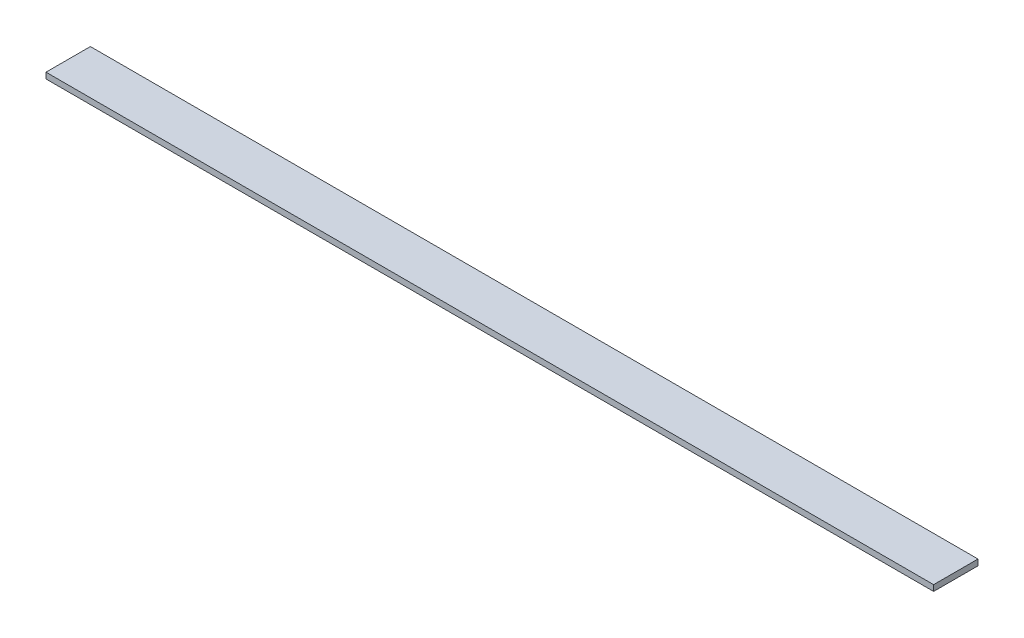
from build123d import *

# Parameters (mm, degrees)
SKETCH1_W           = 15
SKETCH1_H           = 2
BOSS_EXTRUDE1_DEPTH = 300


with BuildPart() as part:
    # Sketch1 → Boss-Extrude1 (new body)
    with BuildSketch(Plane(origin=(0, 0, 0), x_dir=(0, 0, -1), z_dir=(1, 0, 0))):
        Rectangle(SKETCH1_W, SKETCH1_H)
    extrude(amount=BOSS_EXTRUDE1_DEPTH)


solid = part.part
